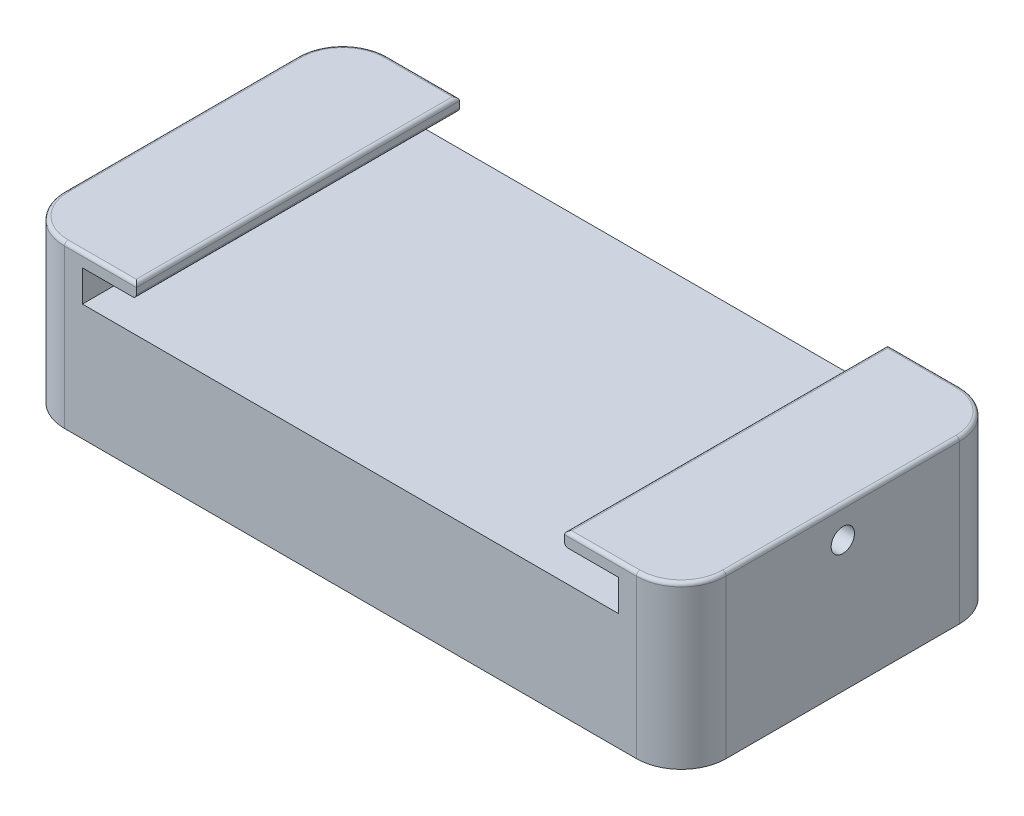
from build123d import *
from OCP.BRepFilletAPI import BRepFilletAPI_MakeFillet

# Parameters (mm, degrees)
BOSS_EXTRUDE1_DEPTH = 12.7
BOSS_EXTRUDE2_START = 10.16
BOSS_EXTRUDE2_DEPTH = 10.16
CUT_EXTRUDE1_REACH  = 103.575
SKETCH5_R           = 1.651
CUT_EXTRUDE2_DEPTH  = 104.355902105
FILLET1_R1          = 0.508
FILLET1_R2          = 1.27


with BuildPart() as part:
    # Sketch1 → Boss-Extrude1 (new body)
    with BuildSketch(Plane(origin=(0, 0, 0), x_dir=(1, 0, 0), z_dir=(0, 1, 0))):
        with BuildLine():
            Line((2.54, -3.81), (83.46, -3.81))
            ThreePointArc((83.46, -3.81), (87.950128061, -1.950128061), (89.81, 2.54))
            Line((89.81, 2.54), (89.81, 35.56))
            ThreePointArc((89.81, 35.56), (87.950128061, 40.050128061), (83.46, 41.91))
            Line((83.46, 41.91), (2.54, 41.91))
            ThreePointArc((2.54, 41.91), (-1.950128061, 40.050128061), (-3.81, 35.56))
            Line((-3.81, 35.56), (-3.81, 2.54))
            ThreePointArc((-3.81, 2.54), (-1.950128061, -1.950128061), (2.54, -3.81))
        make_face()
        with BuildLine():
            Line((2.54, 0), (83.46, 0))
            ThreePointArc((83.46, 0), (85.256051224, 0.743948776), (86, 2.54))
            Line((86, 2.54), (86, 35.56))
            ThreePointArc((86, 35.56), (85.256051224, 37.356051224), (83.46, 38.1))
            Line((83.46, 38.1), (2.54, 38.1))
            ThreePointArc((2.54, 38.1), (0.743948776, 37.356051224), (0, 35.56))
            Line((0, 35.56), (0, 2.54))
            ThreePointArc((0, 2.54), (0.743948776, 0.743948776), (2.54, 0))
        make_face(mode=Mode.SUBTRACT)
    extrude(amount=-BOSS_EXTRUDE1_DEPTH)

    # Sketch3 → Boss-Extrude2 (add)
    with BuildSketch(Plane(origin=(0, 0, 0), x_dir=(1, 0, 0), z_dir=(0, 1, 0)).offset(BOSS_EXTRUDE2_START)):
        with BuildLine():
            Line((83.46, 41.91), (2.54, 41.91))
            ThreePointArc((2.54, 41.91), (-1.950128061, 40.050128061), (-3.81, 35.56))
            Line((-3.81, 35.56), (-3.81, 2.54))
            ThreePointArc((-3.81, 2.54), (-1.950128061, -1.950128061), (2.54, -3.81))
            Line((2.54, -3.81), (83.46, -3.81))
            ThreePointArc((83.46, -3.81), (87.950128061, -1.950128061), (89.81, 2.54))
            Line((89.81, 2.54), (89.81, 35.56))
            ThreePointArc((89.81, 35.56), (87.950128061, 40.050128061), (83.46, 41.91))
        make_face()
    extrude(amount=-BOSS_EXTRUDE2_DEPTH)

    # Sketch4 → Cut-Extrude1 (cut, up to next)
    with BuildSketch(Plane.XY.offset(3.81), mode=Mode.PRIVATE) as cut_extrude1_sk1:
        Polygon((73.3, 10.16), (73.3, 8.255), (80.92, 8.255), (80.92, 3.81), (5.08, 3.81), (5.08, 8.255), (12.7, 8.255), (12.7, 10.16), align=None)
    cut_extrude1_tool1 = extrude(cut_extrude1_sk1.sketch, amount=-CUT_EXTRUDE1_REACH, mode=Mode.PRIVATE) & part.part
    add(cut_extrude1_tool1.solids().sort_by_distance((43, 6.842422, 3.81))[0], mode=Mode.SUBTRACT)

    # Sketch5 → Cut-Extrude2 (cut, through all)
    with BuildSketch(Plane(origin=(89.81, 0, 0), x_dir=(0, 0, -1), z_dir=(1, 0, 0))):
        with Locations((19.05, 5.8325)):
            Circle(SKETCH5_R)
    extrude(amount=-CUT_EXTRUDE2_DEPTH, mode=Mode.SUBTRACT)

    # Fillet1: one fillet with a radius per group of edges: ONE call of the kernel's fillet builder (fillet() takes one radius for all edges)
    fillet1_edges_1 = [part.edges().sort_by_distance(p)[0] for p in [
        (12.7, 8.255, -19.05),
        (73.3, 8.255, -19.05),
        (12.7, 10.16, -19.05),
        (73.3, 10.16, -19.05),
        (7.62, 10.16, -41.91),
        (78.38, 10.16, -41.91),
    ]]
    fillet1_edges_2 = [part.edges().sort_by_distance(p)[0] for p in [
        (43, -12.7, 0),
    ]]
    fillet1 = BRepFilletAPI_MakeFillet(part.part.solid().wrapped)
    for e in fillet1_edges_1:
        fillet1.Add(FILLET1_R1, e.wrapped)
    for e in fillet1_edges_2:
        fillet1.Add(FILLET1_R2, e.wrapped)
    add(Compound.cast(fillet1.Shape()), mode=Mode.REPLACE)


solid = part.part
